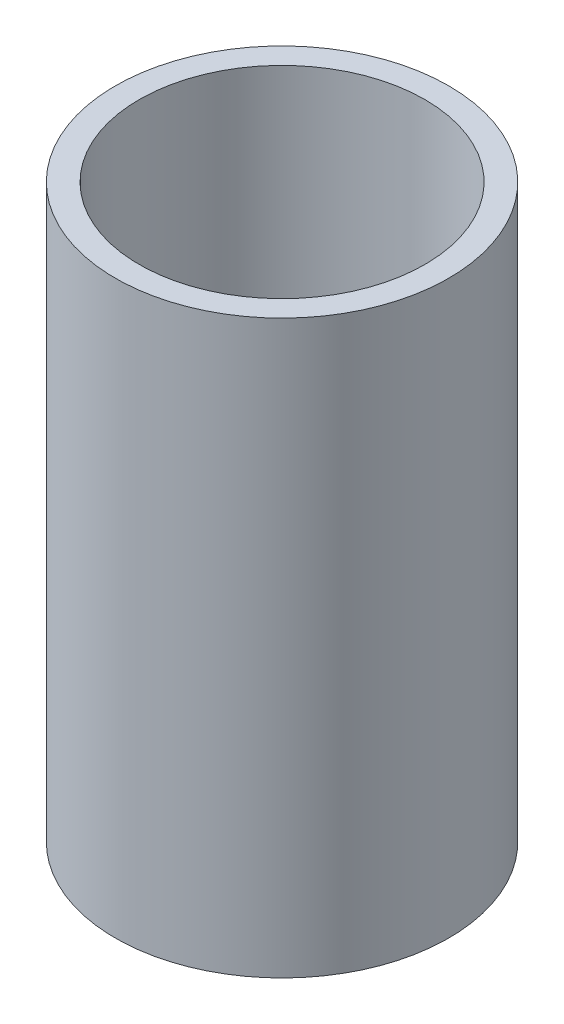
from build123d import *

# Parameters (mm, degrees)
SKETCH1_R           = 22.225
SKETCH1_R_2         = 19.05
BOSS_EXTRUDE1_DEPTH = 76.2


with BuildPart() as part:
    # Sketch1 → Boss-Extrude1 (new body)
    with BuildSketch(Plane(origin=(0, 0, 0), x_dir=(1, 0, 0), z_dir=(0, 1, 0))):
        with Locations(Location((0, 0, 0), (0, 0, 90))):
            Circle(SKETCH1_R)
        with Locations(Location((0, 0, 0), (0, 0, 90))):
            Circle(SKETCH1_R_2, mode=Mode.SUBTRACT)
    extrude(amount=BOSS_EXTRUDE1_DEPTH)


solid = part.part
